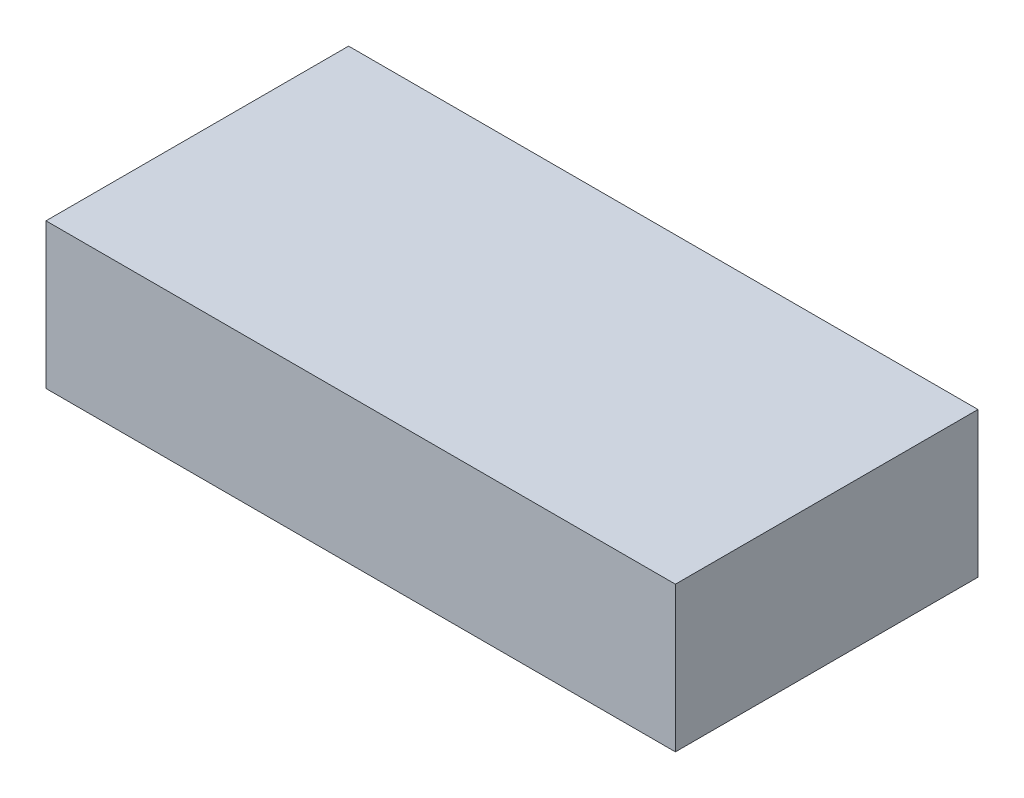
from build123d import *

# Parameters (mm, degrees)
SKETCH1_W           = 52
SKETCH1_H           = 25
BOSS_EXTRUDE1_DEPTH = 12


with BuildPart() as part:
    # Sketch1 → Boss-Extrude1 (new body)
    with BuildSketch(Plane(origin=(0, 0, 0), x_dir=(1, 0, 0), z_dir=(0, 1, 0))):
        Rectangle(SKETCH1_W, SKETCH1_H)
    extrude(amount=BOSS_EXTRUDE1_DEPTH)


solid = part.part
